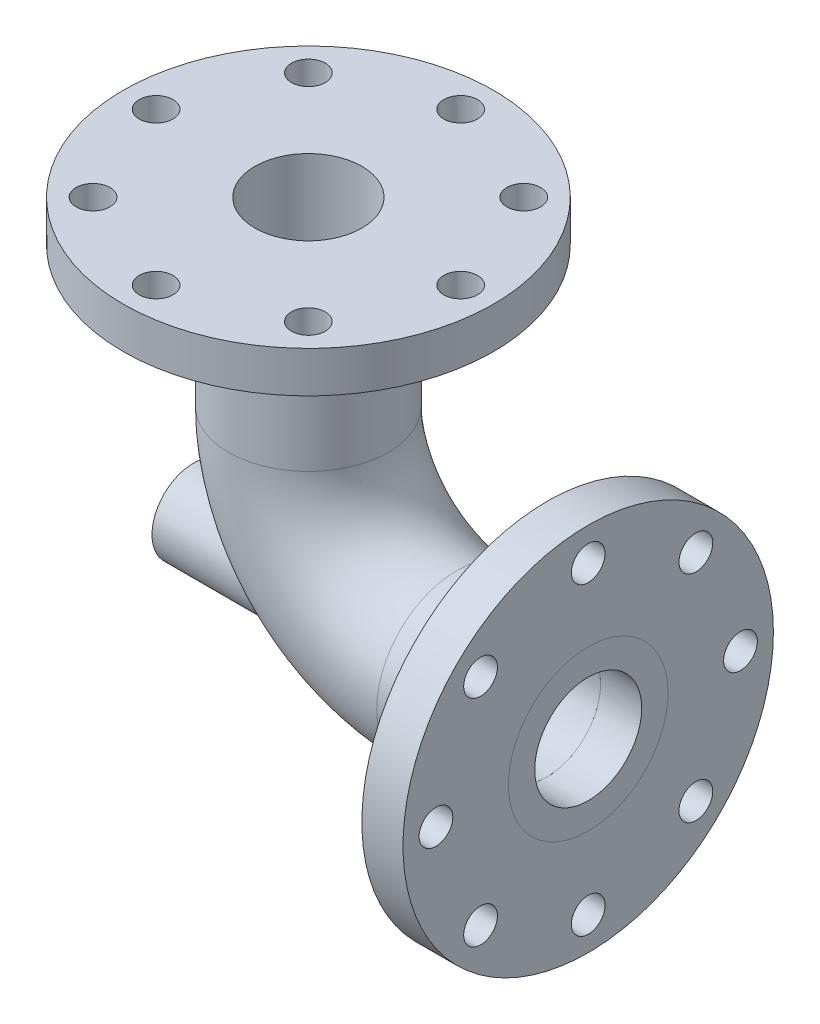
from build123d import *
from build123d.topology import SkipClean

# Parameters (mm, degrees)
SWEEP_THIN1_PROFILE_R          = 48.5
SWEEP_THIN1_PROFILE_R_2        = 32.5
SKETCH18_R                     = 112.5
SKETCH18_R_2                   = 48.5
BOSS_EXTRUDE2_DEPTH            = 25
SKETCH20_R                     = 10.25
CUT_EXTRUDE1_DEPTH             = 25
SKETCH21_R                     = 112.5
SKETCH21_R_2                   = 32.5
BOSS_EXTRUDE3_DEPTH            = 25
SKETCH22_R                     = 10.25
CUT_EXTRUDE2_DEPTH             = 25
SKETCH24_R                     = 48.5
SKETCH24_R_2                   = 32.5
BOSS_EXTRUDE5_DEPTH            = 25
BOSS_EXTRUDE9_REACH            = 334.049
BOSS_EXTRUDE9_END_MAJOR_RADIUS = 90
BOSS_EXTRUDE9_END_MINOR_RADIUS = 48.5
SKETCH26_R                     = 25
SKETCH30_R                     = 12
SKETCH30_R_2                   = 10
CUT_EXTRUDE4_DEPTH             = 28
SKETCH31_R                     = 10
CUT_EXTRUDE5_DEPTH             = 75


with BuildPart() as part:
    # Sweep-Thin1: sweep along a path in Sketch3
    with BuildLine(Plane.XY) as sweep_thin1_path:
        Line((0, 175), (0, 90))
        ThreePointArc((0, 90), (26.360389693, 26.360389693), (90, 0))
        Line((90, 0), (145, 0))
    # Sweep-Thin1 profile (on start of the path) → Sweep-Thin1 (sweep)
    with BuildSketch(Plane(origin=(0, 175, 0), x_dir=(0, 0, -1), z_dir=(0, -1, 0))):
        Circle(SWEEP_THIN1_PROFILE_R)
        Circle(SWEEP_THIN1_PROFILE_R_2, mode=Mode.SUBTRACT)
    sweep(path=sweep_thin1_path.line)

    # Sketch21 → Boss-Extrude3 (add)
    with SkipClean():  # the faces are left unmerged after this step: merging them gives an invalid solid
        with BuildSketch(Plane(origin=(0, 175, 0), x_dir=(1, 0, 0), z_dir=(0, 1, 0))):
            Circle(SKETCH21_R)
            Circle(SKETCH21_R_2, mode=Mode.SUBTRACT)
        extrude(amount=BOSS_EXTRUDE3_DEPTH)

    # Sketch22 → Cut-Extrude2 (cut)
    with SkipClean():  # the faces are left unmerged after this step: merging them gives an invalid solid
        with BuildSketch(Plane(origin=(0, 200, 0), x_dir=(1, 0, 0), z_dir=(0, 1, 0))):
            with Locations((0, 92.5)):
                Circle(SKETCH22_R)
            with Locations((65.40737726, 65.40737726)):
                Circle(SKETCH22_R)
            with Locations((92.5, 0)):
                Circle(SKETCH22_R)
            with Locations((65.40737726, -65.40737726)):
                Circle(SKETCH22_R)
            with Locations((0, -92.5)):
                Circle(SKETCH22_R)
            with Locations((-65.40737726, -65.40737726)):
                Circle(SKETCH22_R)
            with Locations((-92.5, 0)):
                Circle(SKETCH22_R)
            with Locations((-65.40737726, 65.40737726)):
                Circle(SKETCH22_R)
        extrude(amount=-CUT_EXTRUDE2_DEPTH, mode=Mode.SUBTRACT)

    # Boss-Extrude9: up to this torus (the profile starts outside it)
    with SkipClean():  # the faces are left unmerged after this step: merging them gives an invalid solid
        boss_extrude9_end = Plane(origin=(90, 90, 0), z_dir=(0, 0, 1)) * Torus(BOSS_EXTRUDE9_END_MAJOR_RADIUS, BOSS_EXTRUDE9_END_MINOR_RADIUS, mode=Mode.PRIVATE)
        # Sketch26 → Boss-Extrude9 (add, up to the surface)
        with BuildSketch(Plane(origin=(-70, 0, 0), x_dir=(0, 0, -1), z_dir=(1, 0, 0)), mode=Mode.PRIVATE) as boss_extrude9_sk1:
            Circle(SKETCH26_R)
        boss_extrude9_tool1 = extrude(boss_extrude9_sk1.sketch, amount=BOSS_EXTRUDE9_REACH, mode=Mode.PRIVATE) - boss_extrude9_end
        add(boss_extrude9_tool1.solids().sort_by_distance((-70, 0, 0))[0])

    # Sketch30 → Cut-Extrude4 (cut)
    with SkipClean():  # the faces are left unmerged after this step: merging them gives an invalid solid
        with BuildSketch(Plane.ZY.offset(70)):
            Circle(SKETCH30_R)
            Circle(SKETCH30_R_2, mode=Mode.SUBTRACT)
        extrude(amount=-CUT_EXTRUDE4_DEPTH, mode=Mode.SUBTRACT)

    # Sketch31 → Cut-Extrude5 (cut)
    with SkipClean():  # the faces are left unmerged after this step: merging them gives an invalid solid
        with BuildSketch(Plane.ZY.offset(70)):
            Circle(SKETCH31_R)
        extrude(amount=-CUT_EXTRUDE5_DEPTH, mode=Mode.SUBTRACT)


with BuildPart() as body_2:
    # Sketch18 → Boss-Extrude2 (new body)
    with BuildSketch(Plane(origin=(145, 0, 0), x_dir=(0, 0, -1), z_dir=(1, 0, 0))):
        Circle(SKETCH18_R)
        Circle(SKETCH18_R_2, mode=Mode.SUBTRACT)
    extrude(amount=BOSS_EXTRUDE2_DEPTH)

    # Sketch20 → Cut-Extrude1 (cut)
    with BuildSketch(Plane(origin=(170, 0, 0), x_dir=(0, 0, -1), z_dir=(1, 0, 0))):
        with Locations((0, 92.5)):
            Circle(SKETCH20_R)
        with Locations((65.40737726, 65.40737726)):
            Circle(SKETCH20_R)
        with Locations((92.5, 0)):
            Circle(SKETCH20_R)
        with Locations((65.40737726, -65.40737726)):
            Circle(SKETCH20_R)
        with Locations((0, -92.5)):
            Circle(SKETCH20_R)
        with Locations((-65.40737726, -65.40737726)):
            Circle(SKETCH20_R)
        with Locations((-92.5, 0)):
            Circle(SKETCH20_R)
        with Locations((-65.40737726, 65.40737726)):
            Circle(SKETCH20_R)
    extrude(amount=-CUT_EXTRUDE1_DEPTH, mode=Mode.SUBTRACT)


with BuildPart() as body_3:
    # Sketch24 → Boss-Extrude5 (new body)
    with BuildSketch(Plane(origin=(170, 0, 0), x_dir=(0, 0, -1), z_dir=(1, 0, 0))):
        Circle(SKETCH24_R)
        Circle(SKETCH24_R_2, mode=Mode.SUBTRACT)
    extrude(amount=-BOSS_EXTRUDE5_DEPTH)


solid = Compound([part.part, body_2.part, body_3.part])
